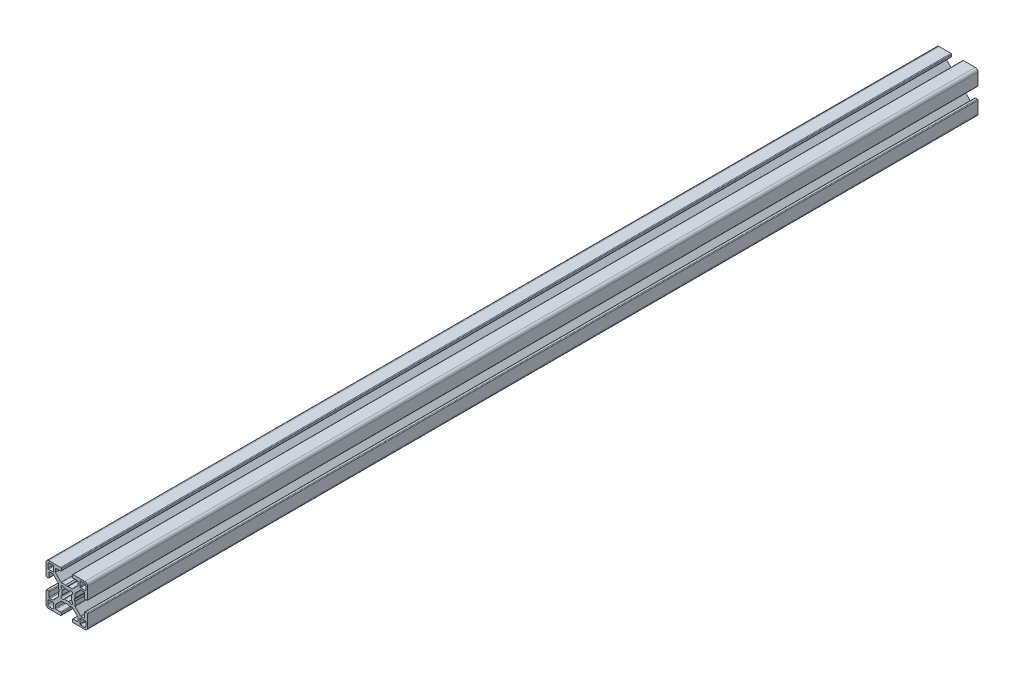
from build123d import *

# Parameters (mm, degrees)
EXTRUDE1_DEPTH = 642


with BuildPart() as part:
    # Sketch1 → Extrude1 (new body)
    with BuildSketch(Plane.XY):
        with BuildLine():
            Line((12.74247465, -4.5), (12.74247465, -7.732519321))
            ThreePointArc((12.74247465, -7.732519321), (12.602449697, -8.097296796), (12.242781236, -8.249967))
            Line((12.242781236, -8.249967), (10.260188032, -8.249967))
            ThreePointArc((10.260188032, -8.249967), (10.068847082, -8.211906919), (9.906636056, -8.103520976))
            Line((9.906636056, -8.103520976), (5.981117769, -4.178002689))
            ThreePointArc((5.981117769, -4.178002689), (5.872731827, -4.015791664), (5.834671745, -3.824450713))
            Line((5.834671745, -3.824450713), (5.834671745, -1.01249595))
            Line((5.834671745, -1.01249595), (5.324673785, -0.06249975))
            Line((5.324673785, -0.06249975), (5.834671745, 0.88749645))
            Line((5.834671745, 0.88749645), (5.834671745, 3.824450713))
            ThreePointArc((5.834671745, 3.824450713), (5.872731827, 4.015791664), (5.981117769, 4.178002689))
            Line((5.981117769, 4.178002689), (9.906636056, 8.103520976))
            ThreePointArc((9.906636056, 8.103520976), (10.068847082, 8.211906919), (10.260188032, 8.249967))
            Line((10.260188032, 8.249967), (12.242781236, 8.249967))
            ThreePointArc((12.242781236, 8.249967), (12.602449697, 8.097296796), (12.74247465, 7.732519321))
            Line((12.74247465, 7.732519321), (12.74247465, 4.5))
            ThreePointArc((12.74247465, 4.5), (12.88892126, 4.146446609), (13.24247465, 4))
            Line((13.24247465, 4), (14.49994, 4))
            ThreePointArc((14.49994, 4), (14.853493391, 4.146446609), (14.99994, 4.5))
            Line((14.99994, 4.5), (14.99994, 12.999948))
            ThreePointArc((14.99994, 12.999948), (14.414155906, 14.414155906), (12.999948, 14.99994))
            Line((12.999948, 14.99994), (4.5, 14.99994))
            ThreePointArc((4.5, 14.99994), (4.146446609, 14.853493391), (4, 14.49994))
            Line((4, 14.49994), (4, 13.24247465))
            ThreePointArc((4, 13.24247465), (4.146446609, 12.88892126), (4.5, 12.74247465))
            Line((4.5, 12.74247465), (7.732519321, 12.74247465))
            ThreePointArc((7.732519321, 12.74247465), (8.097296796, 12.602449697), (8.249967, 12.242781236))
            Line((8.249967, 12.242781236), (8.249967, 10.260188032))
            ThreePointArc((8.249967, 10.260188032), (8.211906919, 10.068847082), (8.103520976, 9.906636056))
            Line((8.103520976, 9.906636056), (4.178002689, 5.981117769))
            ThreePointArc((4.178002689, 5.981117769), (4.015791664, 5.872731827), (3.824450713, 5.834671745))
            Line((3.824450713, 5.834671745), (0.9499962, 5.834671745))
            Line((0.9499962, 5.834671745), (0, 5.324673785))
            Line((0, 5.324673785), (-0.9499962, 5.834671745))
            Line((-0.9499962, 5.834671745), (-3.824450713, 5.834671745))
            ThreePointArc((-3.824450713, 5.834671745), (-4.015791664, 5.872731827), (-4.178002689, 5.981117769))
            Line((-4.178002689, 5.981117769), (-8.103520976, 9.906636056))
            ThreePointArc((-8.103520976, 9.906636056), (-8.211906919, 10.068847082), (-8.249967, 10.260188032))
            Line((-8.249967, 10.260188032), (-8.249967, 12.242781236))
            ThreePointArc((-8.249967, 12.242781236), (-8.097296796, 12.602449697), (-7.732519321, 12.74247465))
            Line((-7.732519321, 12.74247465), (-4.5, 12.74247465))
            ThreePointArc((-4.5, 12.74247465), (-4.146446609, 12.88892126), (-4, 13.24247465))
            Line((-4, 13.24247465), (-4, 14.49994))
            ThreePointArc((-4, 14.49994), (-4.146446609, 14.853493391), (-4.5, 14.99994))
            Line((-4.5, 14.99994), (-12.999948, 14.99994))
            ThreePointArc((-12.999948, 14.99994), (-14.414155906, 14.414155906), (-14.99994, 12.999948))
            Line((-14.99994, 12.999948), (-14.99994, 4.5))
            ThreePointArc((-14.99994, 4.5), (-14.853493391, 4.146446609), (-14.49994, 4))
            Line((-14.49994, 4), (-13.24247465, 4))
            ThreePointArc((-13.24247465, 4), (-12.88892126, 4.146446609), (-12.74247465, 4.5))
            Line((-12.74247465, 4.5), (-12.74247465, 7.732519321))
            ThreePointArc((-12.74247465, 7.732519321), (-12.602449697, 8.097296796), (-12.242781236, 8.249967))
            Line((-12.242781236, 8.249967), (-10.260188032, 8.249967))
            ThreePointArc((-10.260188032, 8.249967), (-10.068847082, 8.211906919), (-9.906636056, 8.103520976))
            Line((-9.906636056, 8.103520976), (-5.981117769, 4.178002689))
            ThreePointArc((-5.981117769, 4.178002689), (-5.872731827, 4.015791664), (-5.834671745, 3.824450713))
            Line((-5.834671745, 3.824450713), (-5.834671745, 0.88749645))
            Line((-5.834671745, 0.88749645), (-5.324673785, -0.06249975))
            Line((-5.324673785, -0.06249975), (-5.834671745, -1.01249595))
            Line((-5.834671745, -1.01249595), (-5.834671745, -3.824450713))
            ThreePointArc((-5.834671745, -3.824450713), (-5.872731827, -4.015791664), (-5.981117769, -4.178002689))
            Line((-5.981117769, -4.178002689), (-9.906636056, -8.103520976))
            ThreePointArc((-9.906636056, -8.103520976), (-10.068847082, -8.211906919), (-10.260188032, -8.249967))
            Line((-10.260188032, -8.249967), (-12.242781236, -8.249967))
            ThreePointArc((-12.242781236, -8.249967), (-12.602449697, -8.097296796), (-12.74247465, -7.732519321))
            Line((-12.74247465, -7.732519321), (-12.74247465, -4.5))
            ThreePointArc((-12.74247465, -4.5), (-12.88892126, -4.146446609), (-13.24247465, -4))
            Line((-13.24247465, -4), (-14.49994, -4))
            ThreePointArc((-14.49994, -4), (-14.853493391, -4.146446609), (-14.99994, -4.5))
            Line((-14.99994, -4.5), (-14.99994, -12.999948))
            ThreePointArc((-14.99994, -12.999948), (-14.414155906, -14.414155906), (-12.999948, -14.99994))
            Line((-12.999948, -14.99994), (-4.5, -14.99994))
            ThreePointArc((-4.5, -14.99994), (-4.146446609, -14.853493391), (-4, -14.49994))
            Line((-4, -14.49994), (-4, -13.24247465))
            ThreePointArc((-4, -13.24247465), (-4.146446609, -12.88892126), (-4.5, -12.74247465))
            Line((-4.5, -12.74247465), (-7.732519321, -12.74247465))
            ThreePointArc((-7.732519321, -12.74247465), (-8.097296796, -12.602449697), (-8.249967, -12.242781236))
            Line((-8.249967, -12.242781236), (-8.249967, -10.260188032))
            ThreePointArc((-8.249967, -10.260188032), (-8.211906919, -10.068847082), (-8.103520976, -9.906636056))
            Line((-8.103520976, -9.906636056), (-4.178002689, -5.981117769))
            ThreePointArc((-4.178002689, -5.981117769), (-4.015791664, -5.872731827), (-3.824450713, -5.834671745))
            Line((-3.824450713, -5.834671745), (-0.9499962, -5.834671745))
            Line((-0.9499962, -5.834671745), (0, -5.324673785))
            Line((0, -5.324673785), (0.9499962, -5.834671745))
            Line((0.9499962, -5.834671745), (3.824450713, -5.834671745))
            ThreePointArc((3.824450713, -5.834671745), (4.015791664, -5.872731827), (4.178002689, -5.981117769))
            Line((4.178002689, -5.981117769), (8.103520976, -9.906636056))
            ThreePointArc((8.103520976, -9.906636056), (8.211906919, -10.068847082), (8.249967, -10.260188032))
            Line((8.249967, -10.260188032), (8.249967, -12.242781236))
            ThreePointArc((8.249967, -12.242781236), (8.097296796, -12.602449697), (7.732519321, -12.74247465))
            Line((7.732519321, -12.74247465), (4.5, -12.74247465))
            ThreePointArc((4.5, -12.74247465), (4.146446609, -12.88892126), (4, -13.24247465))
            Line((4, -13.24247465), (4, -14.49994))
            ThreePointArc((4, -14.49994), (4.146446609, -14.853493391), (4.5, -14.99994))
            Line((4.5, -14.99994), (12.999948, -14.99994))
            ThreePointArc((12.999948, -14.99994), (14.414155906, -14.414155906), (14.99994, -12.999948))
            Line((14.99994, -12.999948), (14.99994, -4.5))
            ThreePointArc((14.99994, -4.5), (14.853493391, -4.146446609), (14.49994, -4))
            Line((14.49994, -4), (13.24247465, -4))
            ThreePointArc((13.24247465, -4), (12.88892126, -4.146446609), (12.74247465, -4.5))
        make_face()
        with BuildLine():
            Line((9.499962, -13.318946724), (9.499962, -9.87996048))
            ThreePointArc((9.499962, -9.87996048), (9.611260978, -9.611260978), (9.87996048, -9.499962))
            Line((9.87996048, -9.499962), (13.318946724, -9.499962))
            ThreePointArc((13.318946724, -9.499962), (13.58835333, -9.61155387), (13.6999452, -9.880960476))
            Line((13.6999452, -9.880960476), (13.6999452, -12.6999492))
            ThreePointArc((13.6999452, -12.6999492), (13.407053153, -13.407053153), (12.6999492, -13.6999452))
            Line((12.6999492, -13.6999452), (9.880960476, -13.6999452))
            ThreePointArc((9.880960476, -13.6999452), (9.61155387, -13.58835333), (9.499962, -13.318946724))
        make_face(mode=Mode.SUBTRACT)
        with BuildLine():
            Line((-13.318946724, -9.499962), (-9.87996048, -9.499962))
            ThreePointArc((-9.87996048, -9.499962), (-9.611260978, -9.611260978), (-9.499962, -9.87996048))
            Line((-9.499962, -9.87996048), (-9.499962, -13.318946724))
            ThreePointArc((-9.499962, -13.318946724), (-9.61155387, -13.58835333), (-9.880960476, -13.6999452))
            Line((-9.880960476, -13.6999452), (-12.6999492, -13.6999452))
            ThreePointArc((-12.6999492, -13.6999452), (-13.407053153, -13.407053153), (-13.6999452, -12.6999492))
            Line((-13.6999452, -12.6999492), (-13.6999452, -9.880960476))
            ThreePointArc((-13.6999452, -9.880960476), (-13.58835333, -9.61155387), (-13.318946724, -9.499962))
        make_face(mode=Mode.SUBTRACT)
        with BuildLine():
            Line((-1.494225248, -3.198138712), (-2.473341823, -3.979927146))
            ThreePointArc((-2.473341823, -3.979927146), (-3.900227701, -3.900227701), (-3.979927146, -2.473341823))
            Line((-3.979927146, -2.473341823), (-3.198138712, -1.494225248))
            ThreePointArc((-3.198138712, -1.494225248), (-3.52998588, 0), (-3.198138712, 1.494225248))
            Line((-3.198138712, 1.494225248), (-3.979927146, 2.473341823))
            ThreePointArc((-3.979927146, 2.473341823), (-3.900227701, 3.900227701), (-2.473341823, 3.979927146))
            Line((-2.473341823, 3.979927146), (-1.494225248, 3.198138712))
            ThreePointArc((-1.494225248, 3.198138712), (0, 3.52998588), (1.494225248, 3.198138712))
            Line((1.494225248, 3.198138712), (2.473341823, 3.979927146))
            ThreePointArc((2.473341823, 3.979927146), (3.900227701, 3.900227701), (3.979927146, 2.473341823))
            Line((3.979927146, 2.473341823), (3.198138712, 1.494225248))
            ThreePointArc((3.198138712, 1.494225248), (3.52998588, 0), (3.198138712, -1.494225248))
            Line((3.198138712, -1.494225248), (3.979927146, -2.473341823))
            ThreePointArc((3.979927146, -2.473341823), (3.900227701, -3.900227701), (2.473341823, -3.979927146))
            Line((2.473341823, -3.979927146), (1.494225248, -3.198138712))
            ThreePointArc((1.494225248, -3.198138712), (0, -3.52998588), (-1.494225248, -3.198138712))
        make_face(mode=Mode.SUBTRACT)
        with BuildLine():
            Line((-9.499962, 13.318946724), (-9.499962, 9.87996048))
            ThreePointArc((-9.499962, 9.87996048), (-9.611260978, 9.611260978), (-9.87996048, 9.499962))
            Line((-9.87996048, 9.499962), (-13.318946724, 9.499962))
            ThreePointArc((-13.318946724, 9.499962), (-13.58835333, 9.61155387), (-13.6999452, 9.880960476))
            Line((-13.6999452, 9.880960476), (-13.6999452, 12.6999492))
            ThreePointArc((-13.6999452, 12.6999492), (-13.407053153, 13.407053153), (-12.6999492, 13.6999452))
            Line((-12.6999492, 13.6999452), (-9.880960476, 13.6999452))
            ThreePointArc((-9.880960476, 13.6999452), (-9.61155387, 13.58835333), (-9.499962, 13.318946724))
        make_face(mode=Mode.SUBTRACT)
        with BuildLine():
            Line((9.880960476, 13.6999452), (12.6999492, 13.6999452))
            ThreePointArc((12.6999492, 13.6999452), (13.407053153, 13.407053153), (13.6999452, 12.6999492))
            Line((13.6999452, 12.6999492), (13.6999452, 9.880960476))
            ThreePointArc((13.6999452, 9.880960476), (13.58835333, 9.61155387), (13.318946724, 9.499962))
            Line((13.318946724, 9.499962), (9.87996048, 9.499962))
            ThreePointArc((9.87996048, 9.499962), (9.611260978, 9.611260978), (9.499962, 9.87996048))
            Line((9.499962, 9.87996048), (9.499962, 13.318946724))
            ThreePointArc((9.499962, 13.318946724), (9.61155387, 13.58835333), (9.880960476, 13.6999452))
        make_face(mode=Mode.SUBTRACT)
    extrude(amount=-EXTRUDE1_DEPTH)


solid = part.part
